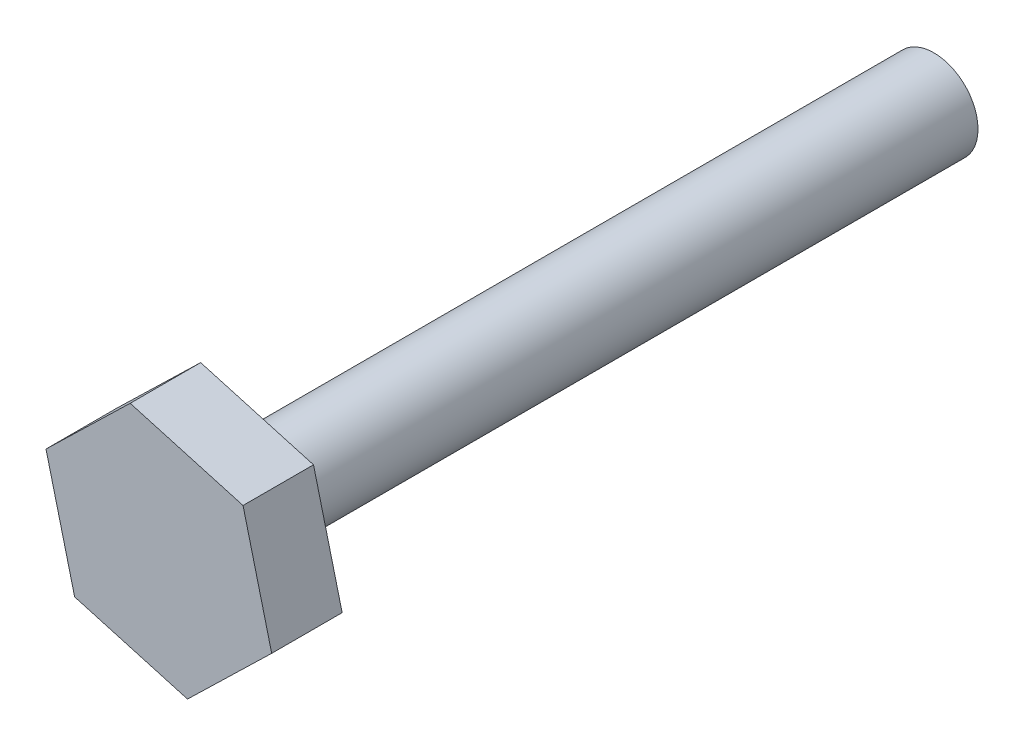
from build123d import *

# Parameters (mm, degrees)
SKETCH_1_R      = 1.25
EXTRUDE_1_DEPTH = 20
EXTRUDE_2_DEPTH = 2


with BuildPart() as part:
    # Эскиз1 → Бобышка-Вытянуть1 (new body)
    with BuildSketch(Plane.XY):
        Circle(SKETCH_1_R)
    extrude(amount=EXTRUDE_1_DEPTH)

    # Эскиз3 → Бобышка-Вытянуть2 (add)
    with BuildSketch(Plane.XY.offset(20)):
        Polygon((2.389686291, 2.318549277), (-0.813079428, 3.228803674), (-3.20276572, 0.910254397), (-2.389686291, -2.318549277), (0.813079428, -3.228803674), (3.20276572, -0.910254397), align=None)
    extrude(amount=EXTRUDE_2_DEPTH)


solid = part.part
